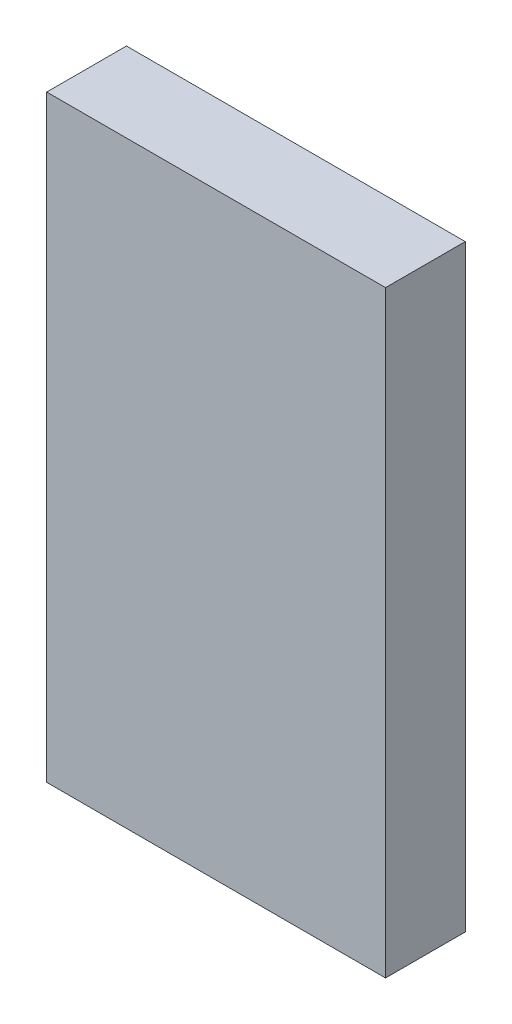
from build123d import *

# Parameters (mm, degrees)
SKETCH1_W           = 42.5
SKETCH1_H           = 75
BOSS_EXTRUDE1_DEPTH = 10


with BuildPart() as part:
    # Sketch1 → Boss-Extrude1 (new body)
    with BuildSketch(Plane.XY):
        Rectangle(SKETCH1_W, SKETCH1_H)
    extrude(amount=BOSS_EXTRUDE1_DEPTH)


solid = part.part
